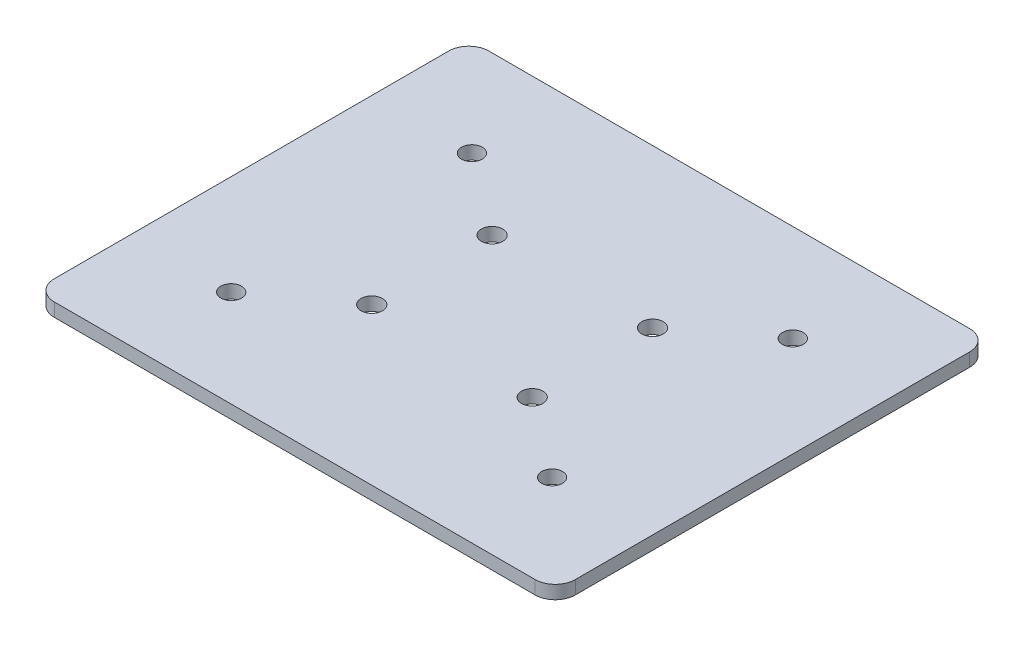
from build123d import *

# Parameters (mm, degrees)
SKETCH1_W               = 77.928270256
SKETCH1_H               = 65
BOSS_EXTRUDE1_DEPTH     = 2
CUT_EXTRUDE3_DEPTH      = 51.778477983
CUT_EXTRUDE3_DEPTH_BACK = 51.778477983
SKETCH2_R               = 1.55
SKETCH2_R_2             = 1.6
FILLET1_R               = 3


with BuildPart() as part:
    # Sketch1 → Boss-Extrude1 (new body)
    with BuildSketch(Plane(origin=(0, 0, 0), x_dir=(1, 0, 0), z_dir=(0, 1, 0))):
        Rectangle(SKETCH1_W, SKETCH1_H)
    extrude(amount=BOSS_EXTRUDE1_DEPTH)

    # Sketch2 → Cut-Extrude3 (cut, two sides: drawn at the far end of the back side and taken through both)
    with BuildSketch(Plane(origin=(0, 2, 0), x_dir=(1, 0, 0), z_dir=(0, 1, 0)).offset(-CUT_EXTRUDE3_DEPTH_BACK)):
        with Locations(Location((-24, 18, 0), (0, 0, 270))):
            Circle(SKETCH2_R)
        with Locations(Location((24, 18, 0), (0, 0, 270))):
            Circle(SKETCH2_R)
        with Locations(Location((24, -18, 0), (0, 0, 270))):
            Circle(SKETCH2_R)
        with Locations(Location((-24, -18, 0), (0, 0, 270))):
            Circle(SKETCH2_R)
        with Locations(Location((-11.865042966, 8.887432286, 0), (0, 0, 270))):
            Circle(SKETCH2_R_2)
        with Locations(Location((12.134957034, 8.887432286, 0), (0, 0, 270))):
            Circle(SKETCH2_R_2)
        with Locations(Location((12.134957034, -9.112567714, 0), (0, 0, 270))):
            Circle(SKETCH2_R_2)
        with Locations(Location((-11.865042966, -9.112567714, 0), (0, 0, 270))):
            Circle(SKETCH2_R_2)
    extrude(amount=CUT_EXTRUDE3_DEPTH + CUT_EXTRUDE3_DEPTH_BACK, mode=Mode.SUBTRACT)

    # Fillet1
    fillet1_edges = [part.edges().sort_by_distance(p)[0] for p in [
        (-38.964135128, 1, 32.5),
        (38.964135128, 1, 32.5),
        (38.964135128, 1, -32.5),
        (-38.964135128, 1, -32.5),
    ]]
    fillet(fillet1_edges, radius=FILLET1_R)


solid = part.part
